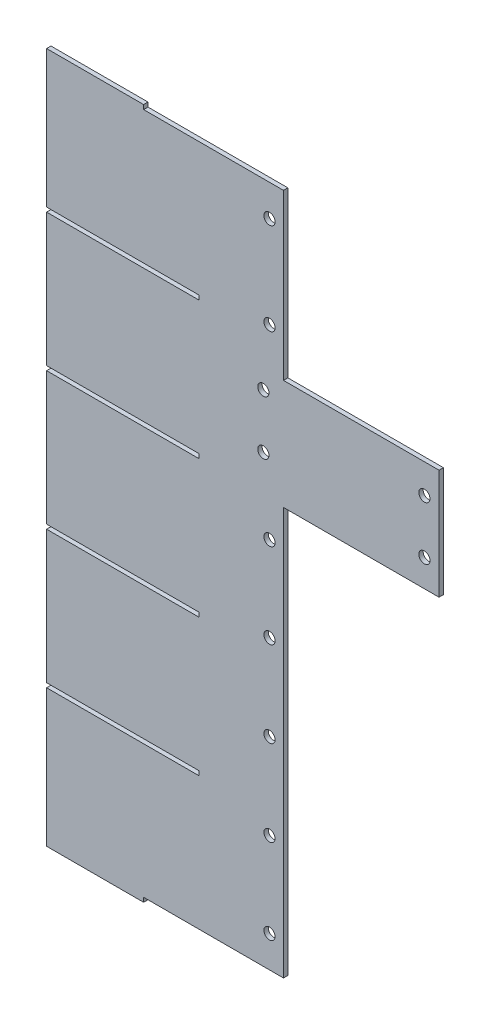
from build123d import *

# Parameters (mm, degrees)
BOSS_EXTRUDE2_DEPTH = 3.175
BOSS_EXTRUDE3_DEPTH = 3.175
SKETCH11_W          = 113.03
SKETCH11_H          = 79.94142
BOSS_EXTRUDE8_DEPTH = 3.175
SKETCH12_W          = 70.49262
SKETCH12_H          = 3.175
BOSS_EXTRUDE9_DEPTH = 3.175
SKETCH15_R          = 4.064
CUT_EXTRUDE1_DEPTH  = 371.49176257
SKETCH16_R          = 4.064
CUT_EXTRUDE2_DEPTH  = 371.49176257


with BuildPart() as part:
    # Sketch1 → Boss-Extrude2 (new body)
    with BuildSketch(Plane.XY):
        Polygon((129.013076168, 254.245404572), (-18.685383832, 254.245404572), (-18.685383832, 157.666984572), (92.088461168, 157.666984572), (92.088461168, 154.491984572), (-18.685383832, 154.491984572), (-18.685383832, 57.913564572), (92.088461168, 57.913564572), (92.088461168, 54.738564572), (-18.685383832, 54.738564572), (-18.685383832, -41.839855428), (92.088461168, -41.839855428), (92.088461168, -45.014855428), (-18.685383832, -45.014855428), (-18.685383832, -141.593275428), (92.088461168, -141.593275428), (92.088461168, -144.768275428), (-18.685383832, -144.768275428), (-18.685383832, -241.346695428), (129.013076168, -241.346695428), align=None)
    extrude(amount=BOSS_EXTRUDE2_DEPTH)

    # Sketch4 → Boss-Extrude3 (add, through all)
    with BuildSketch(Plane.XY.offset(3.175)):
        Polygon((129.013076168, 254.245404572), (129.013076168, -241.346695428), (153.407236168, -241.346695428), (153.407236168, -227.262720585), (153.407236168, 240.16142973), (153.407236168, 254.245404572), align=None)
    extrude(amount=-BOSS_EXTRUDE3_DEPTH)

    # Sketch11 → Boss-Extrude8 (add, through all)
    with BuildSketch(Plane.XY.offset(3.175)):
        with Locations((209.922236168, 94.709274572)):
            Rectangle(SKETCH11_W, SKETCH11_H)
    extrude(amount=-BOSS_EXTRUDE8_DEPTH)

    # Sketch12 → Boss-Extrude9 (add, through all)
    with BuildSketch(Plane(origin=(0, 0, 0), x_dir=(-1, 0, 0), z_dir=(0, 0, -1))):
        with Locations((-16.560926168, 255.832904572)):
            Rectangle(SKETCH12_W, SKETCH12_H)
        with Locations((-16.560926168, -242.934195428)):
            Rectangle(SKETCH12_W, SKETCH12_H)
    extrude(amount=-BOSS_EXTRUDE9_DEPTH)

    # Sketch15 → Cut-Extrude1 (cut, through all)
    with BuildSketch(Plane.XY.offset(3.175)):
        with Locations((143.247236168, 231.313297791)):
            Circle(SKETCH15_R)
        with Locations((143.247236168, 164.651984572)):
            Circle(SKETCH15_R)
        with Locations((255.799716168, 113.343984572)):
            Circle(SKETCH15_R)
        with Locations((255.799716168, 74.495671354)):
            Circle(SKETCH15_R)
        with Locations((143.247236168, 29.338564572)):
            Circle(SKETCH15_R)
        with Locations((143.247236168, -32.334232694)):
            Circle(SKETCH15_R)
        with Locations((143.247236168, -94.538012037)):
            Circle(SKETCH15_R)
        with Locations((143.247236168, -156.74179138)):
            Circle(SKETCH15_R)
        with Locations((143.247236168, -218.414588646)):
            Circle(SKETCH15_R)
    extrude(amount=-CUT_EXTRUDE1_DEPTH, mode=Mode.SUBTRACT)

    # Sketch16 → Cut-Extrude2 (cut, through all)
    with BuildSketch(Plane.XY.offset(3.175)):
        with Locations((138.792076168, 121.451235566)):
            Circle(SKETCH16_R)
        with Locations((138.792076168, 82.140925566)):
            Circle(SKETCH16_R)
    extrude(amount=-CUT_EXTRUDE2_DEPTH, mode=Mode.SUBTRACT)


solid = part.part
